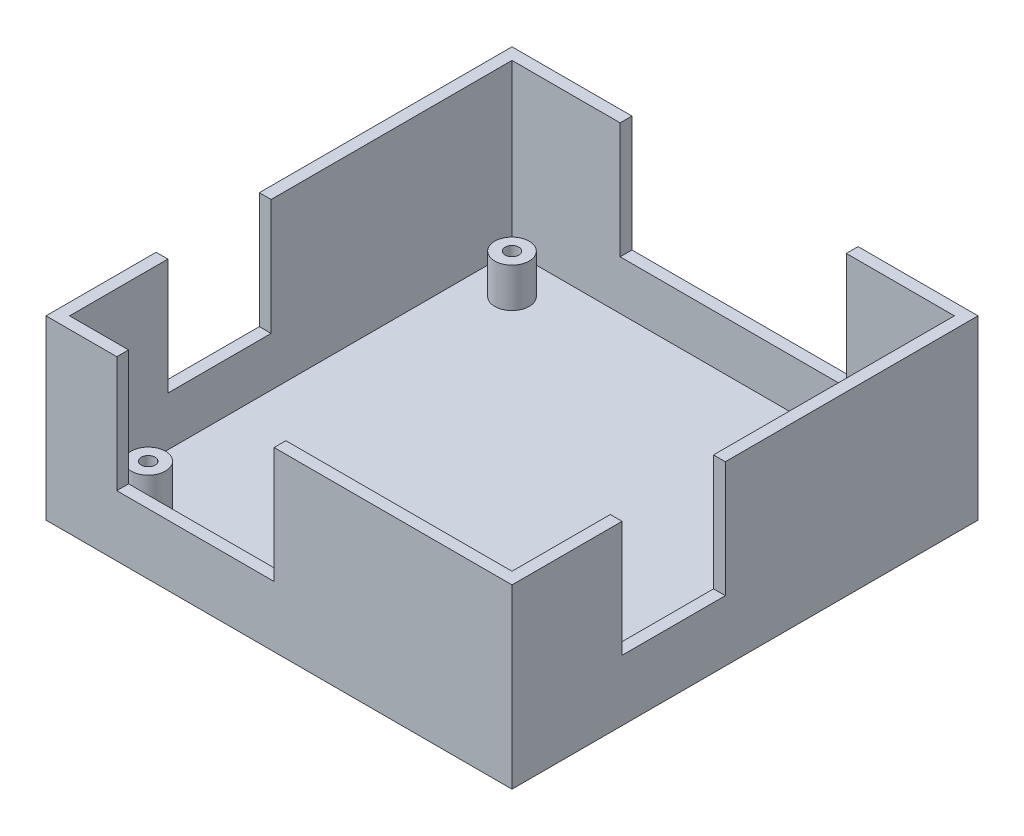
from build123d import *

# Parameters (mm, degrees)
SKETCH1_W           = 47.4
SKETCH1_H           = 47.4
BOSS_EXTRUDE1_DEPTH = 18
SKETCH2_W           = 45
SKETCH2_H           = 45
CUT_EXTRUDE1_DEPTH  = 16.8
SKETCH3_R           = 1.75
BOSS_EXTRUDE2_DEPTH = 4
SKETCH4_R           = 0.7
CUT_EXTRUDE2_DEPTH  = 3
SKETCH5_W           = 16
SKETCH5_H           = 1.2
SKETCH5_W_2         = 1.2
SKETCH5_H_2         = 10.5
SKETCH5_W_3         = 23
CUT_EXTRUDE3_DEPTH  = 11.8


with BuildPart() as part:
    # Sketch1 → Boss-Extrude1 (new body)
    with BuildSketch(Plane(origin=(0, 0, 0), x_dir=(1, 0, 0), z_dir=(0, 1, 0))):
        Rectangle(SKETCH1_W, SKETCH1_H)
    extrude(amount=BOSS_EXTRUDE1_DEPTH)

    # Sketch2 → Cut-Extrude1 (cut)
    with BuildSketch(Plane(origin=(0, 18, 0), x_dir=(1, 0, 0), z_dir=(0, 1, 0))):
        Rectangle(SKETCH2_W, SKETCH2_H)
    extrude(amount=-CUT_EXTRUDE1_DEPTH, mode=Mode.SUBTRACT)

    # Sketch3 → Boss-Extrude2 (add)
    with BuildSketch(Plane(origin=(0, 1.2, 0), x_dir=(1, 0, 0), z_dir=(0, 1, 0))):
        with Locations(Location((-18.5, 18.5, 0), (0, 0, 270))):
            Circle(SKETCH3_R)
        with Locations(Location((18.5, 18.5, 0), (0, 0, 270))):
            Circle(SKETCH3_R)
        with Locations(Location((18.5, -18.5, 0), (0, 0, 270))):
            Circle(SKETCH3_R)
        with Locations(Location((-18.5, -18.5, 0), (0, 0, 270))):
            Circle(SKETCH3_R)
    extrude(amount=BOSS_EXTRUDE2_DEPTH)

    # Sketch4 → Cut-Extrude2 (cut)
    with BuildSketch(Plane(origin=(0, 5.2, 0), x_dir=(1, 0, 0), z_dir=(0, 1, 0))):
        with Locations(Location((-18.5, -18.5, 0), (0, 0, 270))):
            Circle(SKETCH4_R)
        with Locations(Location((-18.5, 18.5, 0), (0, 0, 270))):
            Circle(SKETCH4_R)
        with Locations(Location((18.5, 18.5, 0), (0, 0, 270))):
            Circle(SKETCH4_R)
        with Locations(Location((18.5, -18.5, 0), (0, 0, 270))):
            Circle(SKETCH4_R)
    extrude(amount=-CUT_EXTRUDE2_DEPTH, mode=Mode.SUBTRACT)

    # Sketch5 → Cut-Extrude3 (cut)
    with BuildSketch(Plane(origin=(0, 18, 0), x_dir=(1, 0, 0), z_dir=(0, 1, 0))):
        with Locations((-8.5, -23.1)):
            Rectangle(SKETCH5_W, SKETCH5_H)
        with Locations((23.1, -7.25)):
            Rectangle(SKETCH5_W_2, SKETCH5_H_2)
        with Locations((-23.1, -7.25)):
            Rectangle(SKETCH5_W_2, SKETCH5_H_2)
        with Locations((0, 23.1)):
            Rectangle(SKETCH5_W_3, SKETCH5_H)
    extrude(amount=-CUT_EXTRUDE3_DEPTH, mode=Mode.SUBTRACT)


solid = part.part
